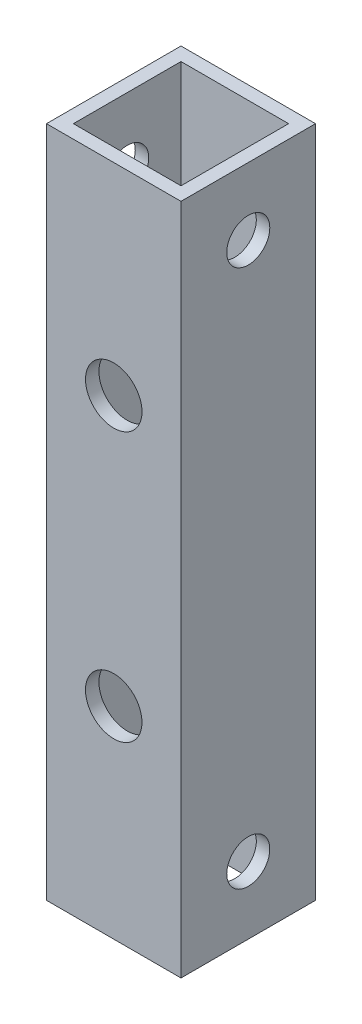
from build123d import *

# Parameters (mm, degrees)
SKETCH_1_W          = 10
SKETCH_1_H          = 10
SKETCH_1_W_2        = 8
SKETCH_1_H_2        = 8
EXTRUDE_1_DEPTH     = 50
SKETCH_2_R          = 1.6
CUT_EXTRUDE_1_DEPTH = 52.23475383
SKETCH_3_R          = 2.1
CUT_EXTRUDE_2_DEPTH = 52.23475383


with BuildPart() as part:
    # ｽｹｯﾁ1 → 押し出し-薄板1 (new body)
    with BuildSketch(Plane(origin=(0, 0, 0), x_dir=(1, 0, 0), z_dir=(0, 1, 0))):
        Rectangle(SKETCH_1_W, SKETCH_1_H)
        Rectangle(SKETCH_1_W_2, SKETCH_1_H_2, mode=Mode.SUBTRACT)
    extrude(amount=EXTRUDE_1_DEPTH)

    # ｽｹｯﾁ2 → ｶｯﾄ - 押し出し1 (cut, through all)
    with BuildSketch(Plane(origin=(5, 0, 0), x_dir=(0, 0, -1), z_dir=(1, 0, 0))):
        with Locations((0, 45)):
            Circle(SKETCH_2_R)
        with Locations((0, 5)):
            Circle(SKETCH_2_R)
    extrude(amount=-CUT_EXTRUDE_1_DEPTH, mode=Mode.SUBTRACT)

    # ｽｹｯﾁ3 → ｶｯﾄ - 押し出し2 (cut, through all)
    with BuildSketch(Plane.XY.offset(5)):
        with Locations((0, 35)):
            Circle(SKETCH_3_R)
        with Locations(Location((0, 15, 0), (0, 0, 180))):
            Circle(SKETCH_3_R)
    extrude(amount=-CUT_EXTRUDE_2_DEPTH, mode=Mode.SUBTRACT)


solid = part.part
